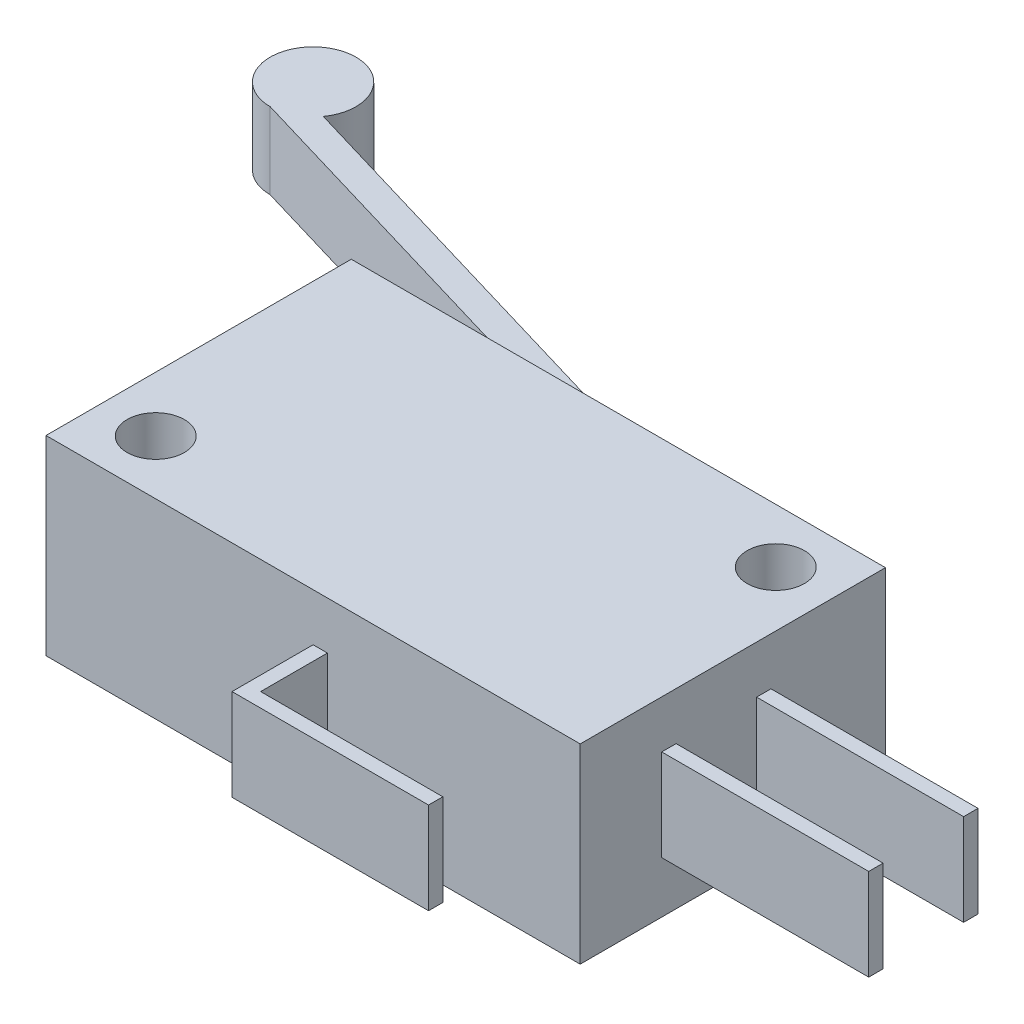
from build123d import *

# Parameters (mm, degrees)
SKETCH1_R           = 1.5
BOSS_EXTRUDE1_DEPTH = 10
BOSS_EXTRUDE2_START = 3.1
BOSS_EXTRUDE2_DEPTH = 4
BOSS_EXTRUDE3_START = 2.7
SKETCH1_4_W         = 10.85
SKETCH1_4_H         = 0.753741083
BOSS_EXTRUDE3_DEPTH = 4.8


with BuildPart() as part:
    # Sketch1 → Boss-Extrude1 (new body)
    with BuildSketch(Plane(origin=(0, 0, 0), x_dir=(1, 0, 0), z_dir=(0, 1, 0))):
        Polygon((15.43, 0), (14, 0), (6.81, 0), (4.25, 0), (0, 0), (0, -16), (14, -16), (14.75, -16), (28, -16), (28, -11.727482166), (28, -10.973741083), (28, -6.753741083), (28, -6), (28, 0), align=None)
        with Locations((2.9, -13.15)):
            Circle(SKETCH1_R, mode=Mode.SUBTRACT)
        with Locations((25.1, -2.85)):
            Circle(SKETCH1_R, mode=Mode.SUBTRACT)
    extrude(amount=BOSS_EXTRUDE1_DEPTH)

    # Sketch1<3> → Boss-Extrude2 (add)
    with BuildSketch(Plane(origin=(0, 0, 0), x_dir=(1, 0, 0), z_dir=(0, 1, 0)).offset(BOSS_EXTRUDE2_START)):
        with BuildLine():
            Line((6.81, 2.13344894), (14, 0))
            Line((14, 0), (15.43, 0))
            Line((15.43, 0), (15.43, 1.494165498))
            Line((15.43, 1.494165498), (14, 1.494165498))
            Line((14, 1.494165498), (-10.114002255, 8.64938004))
            ThreePointArc((-10.114002255, 8.64938004), (-12.983466277, 11.948611382), (-11.95, 7.7))
            Line((-11.95, 7.7), (6.248701299, 2.3))
            Line((6.248701299, 2.3), (4.25, 2.3))
            Line((4.25, 2.3), (4.25, 0))
            Line((4.25, 0), (6.81, 0))
            Line((6.81, 0), (6.81, 2.13344894))
        make_face()
    extrude(amount=BOSS_EXTRUDE2_DEPTH)

    # Sketch1<4> → Boss-Extrude3 (add)
    with BuildSketch(Plane(origin=(0, 0, 0), x_dir=(1, 0, 0), z_dir=(0, 1, 0)).offset(BOSS_EXTRUDE3_START)):
        with Locations((33.425, -6.376870542)):
            Rectangle(SKETCH1_4_W, SKETCH1_4_H)
        with Locations((33.425, -11.350611625)):
            Rectangle(SKETCH1_4_W, SKETCH1_4_H)
        Polygon((14.75, -16), (14, -16), (14, -20.25), (24.3, -20.25), (24.3, -19.5), (14.75, -19.5), align=None)
    extrude(amount=BOSS_EXTRUDE3_DEPTH)


solid = part.part
